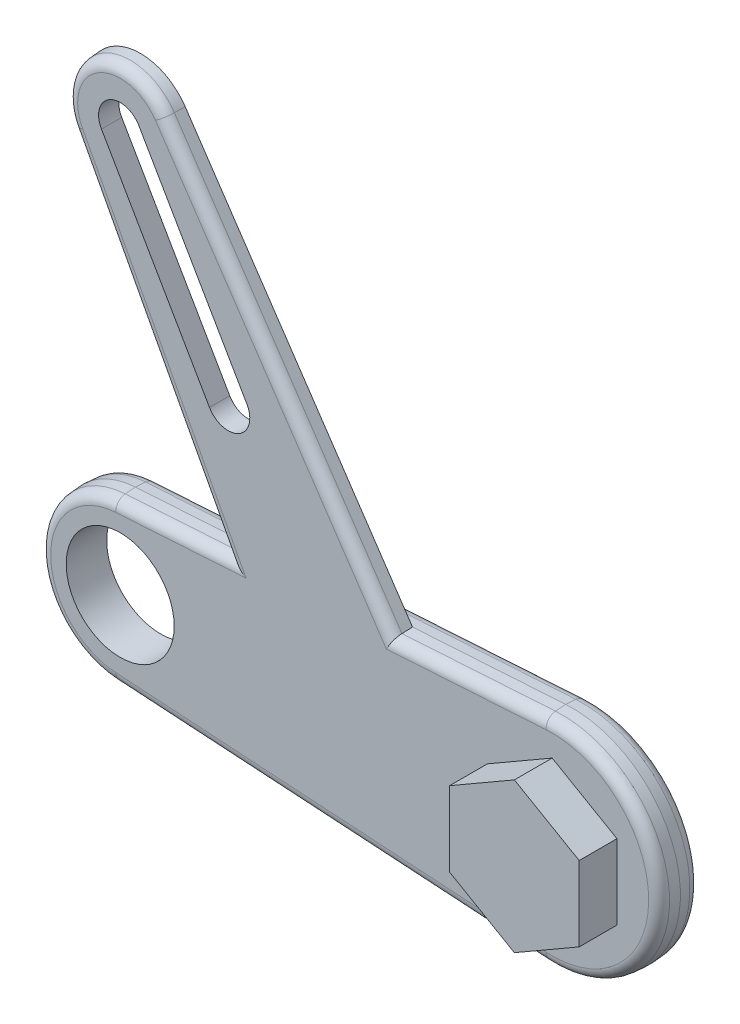
from build123d import *

# Parameters (mm, degrees)
EXTRUDE_366_DEPTH           = 3.75
EXTRUDE_366_TAPER           = 4.000000000000009
EXTRUDE_366_OTHER_WAY_DEPTH = 3.75
EXTRUDE_366_OTHER_WAY_TAPER = 4.000000000000009
EXTRUDE_746_DEPTH           = 3.75
EXTRUDE_746_TAPER           = 4.000000000000009
CUT_EXTRUDE_1239_DEPTH      = 10
SKETCH_4_R                  = 10
CUT_EXTRUDE_1_DEPTH         = 10
EXTRUDE_1783_DEPTH          = 7
FILLET_2_R                  = 2
FILLET_3_R                  = 2


with BuildPart() as part:
    # Эскиз1 → Extrude 366 (new body)
    with BuildSketch(Plane.XY):
        with BuildLine():
            ThreePointArc((-0.9374999999999997, 14.970674458754353), (-15.000000000000044, 1.84e-15), (-0.9374999999999997, -14.970674458754353))
            Line((-0.9374999999999997, -14.970674458754353), (78.75, -19.960899278339134))
            ThreePointArc((78.75, -19.960899278339134), (100, 0), (78.75, 19.960899278339134))
            Line((78.75, 19.960899278339134), (-0.9374999999999997, 14.970674458754353))
        make_face()
    extrude(amount=EXTRUDE_366_DEPTH, taper=EXTRUDE_366_TAPER)

    # Эскиз1 → Extrude 366 other way (add)
    with BuildSketch(Plane.XY):
        with BuildLine():
            ThreePointArc((-0.9374999999999997, 14.970674458754353), (-15.000000000000044, 1.84e-15), (-0.9374999999999997, -14.970674458754353))
            Line((-0.9374999999999997, -14.970674458754353), (78.75, -19.960899278339134))
            ThreePointArc((78.75, -19.960899278339134), (100, 0), (78.75, 19.960899278339134))
            Line((78.75, 19.960899278339134), (-0.9374999999999997, 14.970674458754353))
        make_face()
    extrude(amount=-EXTRUDE_366_OTHER_WAY_DEPTH, taper=EXTRUDE_366_OTHER_WAY_TAPER)

    # Эскиз2 → Extrude 746 (add)
    with BuildSketch(Plane.XY):
        with BuildLine():
            Line((-8.829475928589163, 70.3052843721409), (28.552506867722524, 0))
            Line((28.552506867722524, 0), (62.650318248221396, 1.896e-14))
            Line((62.650318248221396, 1.896e-14), (8.2903757255504, 80.59192903470749))
            ThreePointArc((8.2903757255504, 80.59192903470749), (-5.150380749100648, 83.57167300702106), (-8.829475928589163, 70.3052843721409))
        make_face()
    extrude(amount=EXTRUDE_746_DEPTH, taper=EXTRUDE_746_TAPER)

    # Эскиз3 → Cut-Extrude 1239 (cut)
    with BuildSketch(Plane.XY.offset(3.75)):
        with BuildLine():
            Line((3.464101615137748, 77.00000000000001), (23.464101615137906, 42.35898384862258))
            ThreePointArc((23.464101615137906, 42.35898384862258), (22.00000000000019, 36.89488223348481), (16.53589838486241, 38.358983848622536))
            Line((16.53589838486241, 38.358983848622536), (-3.464101615137746, 72.99999999999997))
            ThreePointArc((-3.464101615137746, 72.99999999999997), (-2.00000000000002, 78.46410161513775), (3.464101615137748, 77.00000000000001))
        make_face()
    extrude(amount=-CUT_EXTRUDE_1239_DEPTH, mode=Mode.SUBTRACT)

    # Эскиз4 → отверстие1 (cut)
    with BuildSketch(Plane.XY.offset(3.75)):
        Circle(SKETCH_4_R)
    extrude(amount=-CUT_EXTRUDE_1_DEPTH, mode=Mode.SUBTRACT)

    # Эскиз5 → Extrude 1783 (add)
    with BuildSketch(Plane.XY.offset(3.75)):
        Polygon((79.99999999999999, 13.856406460551018), (68, 6.928203230275526), (68, -6.9282032302754955), (80, -13.856406460551012), (92, -6.928203230275516), (92, 6.928203230275502), align=None)
    extrude(amount=EXTRUDE_1783_DEPTH)

    # Скругление2
    fillet_2_edges = [part.edges().sort_by_distance(p)[0] for p in [
        (99.73777445521183, -1.332e-14, -3.75),
        (99.73777445521183, -3.77e-15, 3.7499999999999996),
        (9.700092064405581, 15.374087104269854, 3.7499999999999987),
        (-14.737774455211877, -5.44e-15, 3.7499999999999996),
        (38.922639096549254, -17.204073984160544, 3.750000000000001),
        (38.922639096549226, 17.20407398416053, -3.75),
        (64.50880005583919, 18.806341534992715, 3.7499999999999996),
        (-14.737774455211884, -4.44e-15, -3.75),
        (38.92263909654925, -17.204073984160534, -3.75),
    ]]
    fillet(fillet_2_edges, radius=FILLET_2_R)

    # Скругление3
    fillet_3_edges = [part.edges().sort_by_distance(p)[0] for p in [
        (6.342464766178029, 42.32956867017836, 3.7500000000000004),
        (-5.0153246093207, 83.34690184461985, 3.7499999999999996),
        (29.766776124769358, 48.282920306520026, 3.7499999999999885),
    ]]
    fillet(fillet_3_edges, radius=FILLET_3_R)


solid = part.part
